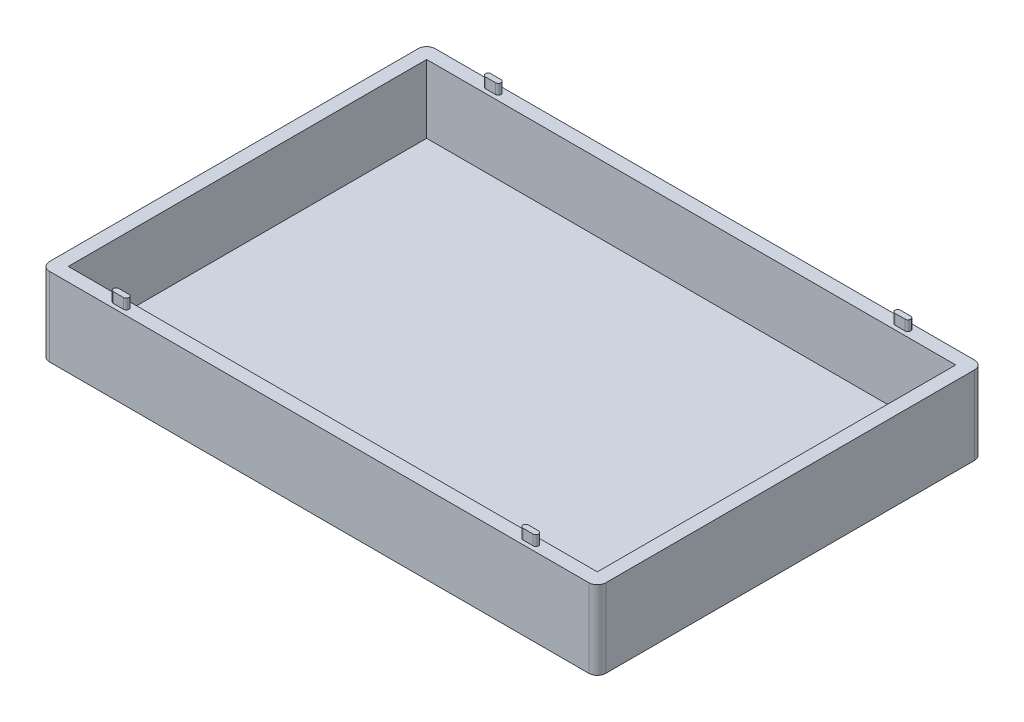
from build123d import *

# Parameters (mm, degrees)
SKETCH1_W           = 163
SKETCH1_H           = 113
OUTERCUT_DEPTH      = 23
FILLET2_R           = 2.5
FILLET3_R           = 2.5
SKETCH2_W           = 155
SKETCH2_H           = 105
INNERCUT_DEPTH      = 20
BOSS_EXTRUDE5_DEPTH = 3


with BuildPart() as part:
    # Sketch1 → OuterCut (new body)
    with BuildSketch(Plane(origin=(0, 0, 0), x_dir=(1, 0, 0), z_dir=(0, 1, 0))):
        Rectangle(SKETCH1_W, SKETCH1_H)
    extrude(amount=OUTERCUT_DEPTH)

    # Fillet2
    fillet2_edges = [part.edges().sort_by_distance(p)[0] for p in [
        (81.5, 11.5, 56.5),
    ]]
    fillet(fillet2_edges, radius=FILLET2_R)

    # Fillet3
    fillet3_edges = [part.edges().sort_by_distance(p)[0] for p in [
        (-81.5, 11.5, 56.5),
        (-81.5, 11.5, -56.5),
        (81.5, 11.5, -56.5),
    ]]
    fillet(fillet3_edges, radius=FILLET3_R)

    # Sketch2 → InnerCut (cut)
    with BuildSketch(Plane(origin=(0, 23, 0), x_dir=(1, 0, 0), z_dir=(0, 1, 0))):
        Rectangle(SKETCH2_W, SKETCH2_H)
    extrude(amount=-INNERCUT_DEPTH, mode=Mode.SUBTRACT)

    # Sketch9 → Boss-Extrude5 (add)
    with BuildSketch(Plane(origin=(0, 23, 0), x_dir=(1, 0, 0), z_dir=(0, 1, 0))):
        with BuildLine():
            Line((58.5, -53.7), (61.5, -53.7))
            ThreePointArc((61.5, -53.7), (62.3, -54.5), (61.5, -55.3))
            Line((61.5, -55.3), (58.5, -55.3))
            ThreePointArc((58.5, -55.3), (57.7, -54.5), (58.5, -53.7))
        make_face()
        with BuildLine():
            Line((-61.5, -53.7), (-58.5, -53.7))
            ThreePointArc((-58.5, -53.7), (-57.7, -54.5), (-58.5, -55.3))
            Line((-58.5, -55.3), (-61.5, -55.3))
            ThreePointArc((-61.5, -55.3), (-62.3, -54.5), (-61.5, -53.7))
        make_face()
        with BuildLine():
            Line((-61.5, 55.3), (-58.5, 55.3))
            ThreePointArc((-58.5, 55.3), (-57.7, 54.5), (-58.5, 53.7))
            Line((-58.5, 53.7), (-61.5, 53.7))
            ThreePointArc((-61.5, 53.7), (-62.3, 54.5), (-61.5, 55.3))
        make_face()
        with BuildLine():
            Line((58.5, 55.3), (61.5, 55.3))
            ThreePointArc((61.5, 55.3), (62.3, 54.5), (61.5, 53.7))
            Line((61.5, 53.7), (58.5, 53.7))
            ThreePointArc((58.5, 53.7), (57.7, 54.5), (58.5, 55.3))
        make_face()
    extrude(amount=BOSS_EXTRUDE5_DEPTH)


solid = part.part
